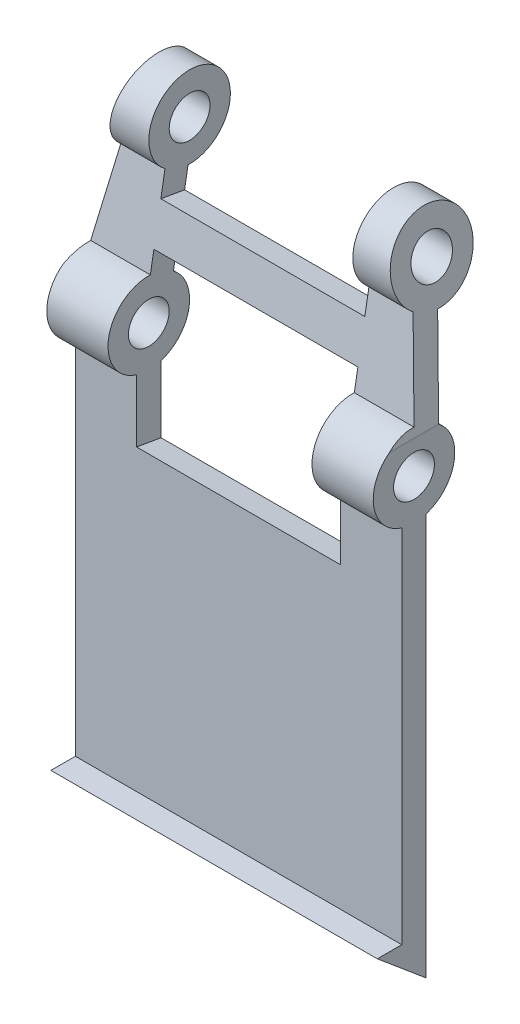
from build123d import *

# Parameters (mm, degrees)
SKETCH1_R               = 2.5
BOSS_EXTRUDE1_DEPTH     = 20
CUT_EXTRUDE1_DEPTH      = 58.772252315
CUT_EXTRUDE1_DEPTH_BACK = 58.772252315
SKETCH2_W               = 25
SKETCH2_H               = 20
CUT_EXTRUDE2_DEPTH      = 58.772252315
CUT_EXTRUDE2_DEPTH_BACK = 58.772252315
SKETCH3_W               = 25
SKETCH3_H               = 12.433791975
CUT_EXTRUDE4_DEPTH      = 59.240774016
CUT_EXTRUDE4_DEPTH_BACK = 59.240774016


with BuildPart() as part:
    # Sketch1 → Boss-Extrude1 (new, symmetric)
    with BuildSketch(Plane(origin=(0, 0, 0), x_dir=(0, 1, 0), z_dir=(-1, 0, 0))):
        with BuildLine():
            Line((-54.034597787, 1.5), (-49, -4.5))
            Line((-49, -4.5), (-49, -1.5))
            Line((-49, -1.5), (-4.769696007, -1.5))
            ThreePointArc((-4.769696007, -1.5), (0.852265487, -4.926828954), (4.996412, 0.18938619))
            Line((4.996412, 0.18938619), (15.376256638, 1.98493936))
            ThreePointArc((15.376256638, 1.98493936), (24.074374147, 6.679586511), (14.368504731, 4.81061381))
            Line((14.368504731, 4.81061381), (3.988660093, 3.01506064))
            ThreePointArc((3.988660093, 3.01506064), (-0.852265487, 4.926828954), (-4.769696007, 1.5))
            Line((-4.769696007, 1.5), (-54.034597787, 1.5))
        make_face()
        with Locations(Location((0, 0, 0), (0, 0, 270))):
            Circle(SKETCH1_R, mode=Mode.SUBTRACT)
        with Locations(Location((19.364916731, 5, 0), (0, 0, 270))):
            Circle(SKETCH1_R, mode=Mode.SUBTRACT)
    extrude(amount=BOSS_EXTRUDE1_DEPTH, both=True)

    # Sketch2 → Cut-Extrude1 (cut, two sides: drawn at the far end of the back side and taken through both)
    with BuildSketch(Plane(origin=(0, -0.390517957, -2.25753032), x_dir=(-1, 0, 0), z_dir=(0, -0.17045309739797798, -0.9853657907535838)).offset(-CUT_EXTRUDE1_DEPTH_BACK)):
        with Locations((0, -2.5)):
            Rectangle(SKETCH2_W, SKETCH2_H)
    extrude(amount=CUT_EXTRUDE1_DEPTH + CUT_EXTRUDE1_DEPTH_BACK, mode=Mode.SUBTRACT)

    # Sketch3 → Cut-Extrude2 (cut, two sides: drawn at the far end of the back side and taken through both)
    with BuildSketch(Plane(origin=(0, -0.390517957, -2.25753032), x_dir=(-1, 0, 0), z_dir=(0, -0.17045309739797798, -0.9853657907535838)).offset(-CUT_EXTRUDE2_DEPTH_BACK)):
        with Locations((0, 18.716895988)):
            Rectangle(SKETCH3_W, SKETCH3_H)
    extrude(amount=CUT_EXTRUDE2_DEPTH + CUT_EXTRUDE2_DEPTH_BACK, mode=Mode.SUBTRACT)

    # Sketch4 → Cut-Extrude4 (cut, two sides: drawn at the far end of the back side and taken through both)
    with BuildSketch(Plane(origin=(0, 0, -1.5), x_dir=(-1, 0, 0), z_dir=(0, 0, -1)).offset(-CUT_EXTRUDE4_DEPTH_BACK)):
        Polygon((-20, 3.988660093), (-16.25, 24.364916731), (-20, 24.364916731), align=None)
        Polygon((20, 3.988660093), (20, 24.364916731), (16.25, 24.364916731), align=None)
    extrude(amount=CUT_EXTRUDE4_DEPTH + CUT_EXTRUDE4_DEPTH_BACK, mode=Mode.SUBTRACT)


solid = part.part
